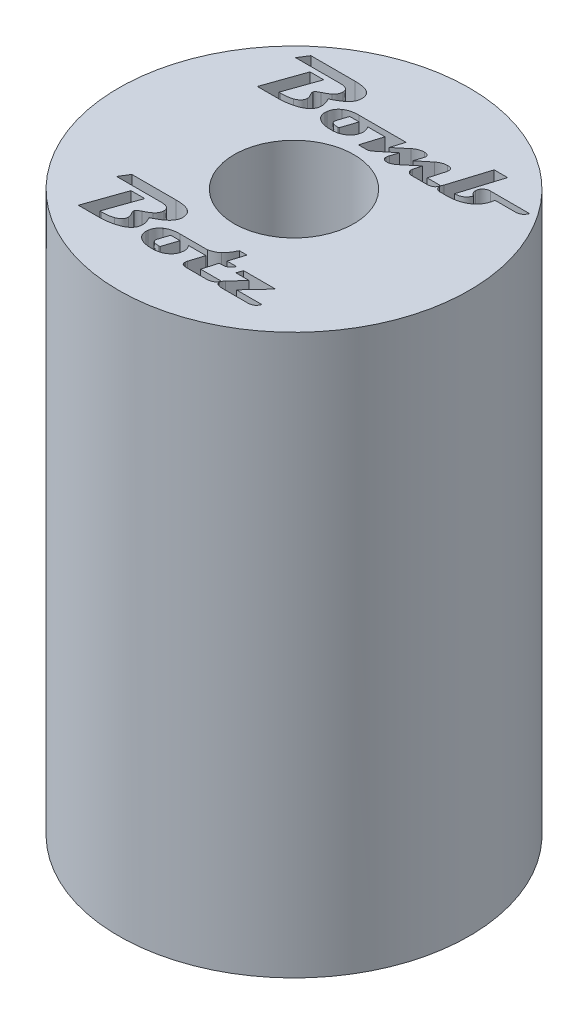
from build123d import *

# Parameters (mm, degrees)
SKETCH1_R           = 10.414
BOSS_EXTRUDE1_DEPTH = 34.798
SKETCH2_R           = 3.556
CUT_EXTRUDE1_DEPTH  = 34.798
CUT_EXTRUDE2_DEPTH  = 2.54
CUT_EXTRUDE3_DEPTH  = 2.54
SKETCH5_R           = 10.414
CUT_EXTRUDE4_DEPTH  = 1.5875


with BuildPart() as part:
    # Sketch1 → Boss-Extrude1 (new body)
    with BuildSketch(Plane(origin=(0, 0, 0), x_dir=(1, 0, 0), z_dir=(0, 1, 0))):
        with Locations(Location((0, 0, 0), (0, 0, 270))):
            Circle(SKETCH1_R)
    extrude(amount=BOSS_EXTRUDE1_DEPTH)

    # Sketch2 → Cut-Extrude1 (cut)
    with BuildSketch(Plane(origin=(0, 34.798, 0), x_dir=(1, 0, 0), z_dir=(0, 1, 0))):
        with Locations(Location((0, 0, 0), (0, 0, 270))):
            Circle(SKETCH2_R)
    extrude(amount=-CUT_EXTRUDE1_DEPTH, mode=Mode.SUBTRACT)

    # Sketch3 → Cut-Extrude2 (cut)
    # profile 1 of 4: a face of its own
    with BuildSketch(Plane(origin=(0, 34.798, 0), x_dir=(1, 0, 0), z_dir=(0, 1, 0))):
        with BuildLine():
            add(Edge.make_bspline(
                [(-2.639323682, 6.655505069), (-2.640257841, 6.627920843), (-2.642120978, 6.572905325), (-2.660323465, 6.491560511), (-2.686788544, 6.411133385), (-2.725680783, 6.332207712), (-2.775669719, 6.255242578), (-2.836178064, 6.179491707), (-2.907290136, 6.104982299), (-2.960926582, 6.058632058), (-2.988600498, 6.034717485)],
                knots=[0, 0, 0, 0, 0.897728408, 1.790479602, 2.704835107, 3.65271708, 4.64870854, 5.690615823, 6.808464946, 8, 8, 8, 8], degree=3))
            add(Edge.make_bspline(
                [(-2.988600498, 6.034717485), (-3.007000622, 6.019776527), (-3.04528941, 5.988685911), (-3.108234785, 5.943919796), (-3.177672512, 5.897701707), (-3.254612313, 5.85109888), (-3.337346824, 5.801886305), (-3.427527735, 5.752619821), (-3.523984699, 5.701259321), (-3.591407946, 5.668255669), (-3.626148007, 5.651250424)],
                knots=[0, 0, 0, 0, 0.762818378, 1.58734759, 2.485155294, 3.447475053, 4.482567251, 5.583716273, 6.755001493, 8, 8, 8, 8], degree=3))
            add(Edge.make_bspline(
                [(-3.626148007, 5.651250424), (-3.612492101, 5.626575614), (-3.585863402, 5.578460309), (-3.551050884, 5.505914721), (-3.521207388, 5.435316908), (-3.497092853, 5.366333186), (-3.478130246, 5.299185034), (-3.464600633, 5.233790105), (-3.456166881, 5.170127282), (-3.455066052, 5.128141469), (-3.454526385, 5.10755849)],
                knots=[0, 0, 0, 0, 1.174121996, 2.289510624, 3.348879741, 4.364175923, 5.330489301, 6.25208496, 7.143108216, 8, 8, 8, 8], degree=3))
            add(Edge.make_bspline(
                [(-3.454526385, 5.10755849), (-3.455098631, 5.086980235), (-3.456234317, 5.046140416), (-3.463548943, 4.985959095), (-3.476305413, 4.927794143), (-3.494671859, 4.872056332), (-3.517348069, 4.818003802), (-3.545837007, 4.766397324), (-3.578739355, 4.716407844), (-3.617196077, 4.668670685), (-3.660973764, 4.623226953), (-3.709418913, 4.579321964), (-3.763251979, 4.538049428), (-3.821581966, 4.498101026), (-3.885892221, 4.461574208), (-3.954525885, 4.425901747), (-4.028853301, 4.393128995), (-4.080375064, 4.373053025), (-4.106822627, 4.362747468)],
                knots=[0, 0, 0, 0, 0.930762157, 1.847200212, 2.737400411, 3.619588674, 4.498179705, 5.384699949, 6.281759375, 7.202035291, 8.152832479, 9.1332533, 10.156253164, 11.218736018, 12.328253921, 13.499059235, 14.716197083, 16, 16, 16, 16], degree=3))
            add(Edge.make_bspline(
                [(-4.106822627, 4.362747468), (-4.146466281, 4.348925535), (-4.226464054, 4.321033964), (-4.35050715, 4.286333614), (-4.479164833, 4.256921012), (-4.612941023, 4.232776971), (-4.751419543, 4.214180302), (-4.894773857, 4.200817703), (-5.042823565, 4.192616535), (-5.143245708, 4.191627664), (-5.194206495, 4.191125846)],
                knots=[0, 0, 0, 0, 0.910500009, 1.837317329, 2.792105238, 3.772355063, 4.784863345, 5.821858577, 6.894668061, 8, 8, 8, 8], degree=3))
            Line((-5.194206495, 4.191125846), (-6.372093953, 4.191125846))
            Line((-6.372093953, 4.191125846), (-5.55689125, 6.508017738))
            Line((-5.55689125, 6.508017738), (-4.74101815, 6.508017738))
            Line((-4.74101815, 6.508017738), (-5.436890194, 4.534369089))
            Line((-5.436890194, 4.534369089), (-5.323593108, 4.534369089))
            add(Edge.make_bspline(
                [(-5.323593108, 4.534369089), (-5.261428374, 4.535560384), (-5.141553774, 4.537857602), (-4.969388946, 4.554356283), (-4.811580271, 4.58212015), (-4.713745036, 4.611875938), (-4.666604088, 4.626213473)],
                knots=[0, 0, 0, 0, 1.119726035, 2.159209934, 3.113033349, 4, 4, 4, 4], degree=3))
            add(Edge.make_bspline(
                [(-4.666604088, 4.626213473), (-4.635209507, 4.637973902), (-4.575224084, 4.660444479), (-4.494203606, 4.704628616), (-4.424847023, 4.753243256), (-4.368293394, 4.808247106), (-4.32339765, 4.868571559), (-4.292549485, 4.935511424), (-4.272769047, 5.00766025), (-4.270756541, 5.057817319), (-4.269729088, 5.083424199)],
                knots=[0, 0, 0, 0, 1.235683897, 2.361013278, 3.395291283, 4.351587988, 5.260345797, 6.153024808, 7.057056699, 8, 8, 8, 8], degree=3))
            add(Edge.make_bspline(
                [(-4.269729088, 5.083424199), (-4.270897897, 5.101178368), (-4.273395162, 5.139111708), (-4.290976065, 5.197684032), (-4.317988609, 5.261063543), (-4.355108968, 5.325016942), (-4.391960784, 5.386736404), (-4.41884019, 5.443163484), (-4.436908484, 5.489967391), (-4.440017286, 5.51885775), (-4.441350709, 5.531249368)],
                knots=[0, 0, 0, 0, 0.878868266, 1.877779235, 3.008481529, 4.286715377, 5.53601311, 6.565782224, 7.38483702, 8, 8, 8, 8], degree=3))
            add(Edge.make_bspline(
                [(-4.441350709, 5.531249368), (-4.44127029, 5.54045414), (-4.441136075, 5.555816331), (-4.437939265, 5.570821887), (-4.436657931, 5.576836361)],
                knots=[0, 0, 0, 0, 1.198367028, 2, 2, 2, 2], degree=3))
            add(Edge.make_bspline(
                [(-4.436657931, 5.576836361), (-4.426194835, 5.593938034), (-4.403050087, 5.631767557), (-4.347140129, 5.680953545), (-4.272430561, 5.728624061), (-4.21465204, 5.757109618), (-4.18324788, 5.772592274)],
                knots=[0, 0, 0, 0, 0.735710686, 1.627418776, 2.710439134, 4, 4, 4, 4], degree=3))
            add(Edge.make_bspline(
                [(-4.18324788, 5.772592274), (-4.138278926, 5.79396403), (-4.053813257, 5.83410683), (-3.939495523, 5.898214482), (-3.842695694, 5.957215911), (-3.788467639, 6.00068759), (-3.763579383, 6.020639149)],
                knots=[0, 0, 0, 0, 1.221943044, 2.295188721, 3.217567763, 4, 4, 4, 4], degree=3))
            add(Edge.make_bspline(
                [(-3.763579383, 6.020639149), (-3.745843832, 6.036411831), (-3.71119367, 6.067227112), (-3.665646811, 6.117581551), (-3.626961934, 6.169634389), (-3.595044382, 6.223376235), (-3.570786547, 6.279563446), (-3.553451561, 6.3373831), (-3.54201875, 6.396953675), (-3.54090121, 6.437350177), (-3.540337196, 6.457737966)],
                knots=[0, 0, 0, 0, 1.121998031, 2.192061215, 3.204672358, 4.185392352, 5.141656817, 6.09129737, 7.036693171, 8, 8, 8, 8], degree=3))
            add(Edge.make_bspline(
                [(-3.540337196, 6.457737966), (-3.540737449, 6.471830385), (-3.541522723, 6.499478944), (-3.547235063, 6.539688021), (-3.558465668, 6.576782363), (-3.572200382, 6.611629537), (-3.591380591, 6.643205807), (-3.614313612, 6.672520141), (-3.64185241, 6.698439748), (-3.673489485, 6.721604192), (-3.708661441, 6.742287667), (-3.748432077, 6.759635811), (-3.791731634, 6.775293292), (-3.839949984, 6.786848656), (-3.891753237, 6.797192448), (-3.948033033, 6.803557755), (-4.008211363, 6.807659783), (-4.049831183, 6.808118861), (-4.071291588, 6.808355576)],
                knots=[0, 0, 0, 0, 0.937953779, 1.840214304, 2.692042798, 3.512259584, 4.325843598, 5.141056955, 5.982567789, 6.83322717, 7.746330073, 8.691564934, 9.716930283, 10.806196192, 11.987412167, 13.230656729, 14.572045042, 16, 16, 16, 16], degree=3))
            Line((-4.071291588, 6.808355576), (-6.715337196, 6.808355576))
            Line((-6.715337196, 6.808355576), (-6.368071571, 7.366125846))
            Line((-6.368071571, 7.366125846), (-3.735422711, 7.366125846))
            add(Edge.make_bspline(
                [(-3.735422711, 7.366125846), (-3.693623766, 7.365828929), (-3.612426256, 7.365252146), (-3.494802479, 7.358281193), (-3.385129402, 7.347960683), (-3.283700858, 7.332696994), (-3.190345325, 7.312655766), (-3.10503278, 7.288530767), (-3.027198219, 7.261116476), (-2.979902787, 7.237434755), (-2.957091841, 7.226012882)],
                knots=[0, 0, 0, 0, 1.256746755, 2.441322517, 3.541898803, 4.568277561, 5.523823565, 6.410850237, 7.23354099, 8, 8, 8, 8], degree=3))
            add(Edge.make_bspline(
                [(-2.957091841, 7.226012882), (-2.931791501, 7.211321072), (-2.882300825, 7.182582027), (-2.817640596, 7.127831376), (-2.761751416, 7.067239038), (-2.716225703, 6.998799805), (-2.682183982, 6.922673102), (-2.657413462, 6.839993764), (-2.641406475, 6.750198805), (-2.640033029, 6.687755348), (-2.639323682, 6.655505069)],
                knots=[0, 0, 0, 0, 1.016794796, 1.988979663, 2.936190502, 3.879110517, 4.836521918, 5.828337036, 6.878397495, 8, 8, 8, 8], degree=3))
        make_face()
    # profile 2 of 4: a face of its own
    with BuildSketch(Plane(origin=(0, 34.798, 0), x_dir=(1, 0, 0), z_dir=(0, 1, 0))):
        with BuildLine():
            add(Edge.make_bspline(
                [(0.921824966, 5.735720441), (0.913441583, 5.708501066), (0.897173822, 5.655682503), (0.856582376, 5.584676373), (0.804816788, 5.524393773), (0.741061374, 5.475410784), (0.665935035, 5.43767316), (0.579821814, 5.411326872), (0.482652984, 5.3950869), (0.414180469, 5.393377247), (0.378133032, 5.392477197)],
                knots=[0, 0, 0, 0, 0.974814121, 1.891604083, 2.783133621, 3.684923962, 4.631341703, 5.652256529, 6.764027661, 8, 8, 8, 8], degree=3))
            Line((0.378133032, 5.392477197), (-1.040426934, 5.392477197))
            add(Edge.make_bspline(
                [(-1.040426934, 5.392477197), (-1.028116517, 5.382663883), (-1.002051862, 5.361886304), (-0.970519394, 5.31878722), (-0.941326595, 5.266421158), (-0.917523737, 5.205461584), (-0.898036471, 5.141963798), (-0.884237727, 5.080856302), (-0.877322117, 5.023886385), (-0.879267843, 4.98756596), (-0.880202061, 4.970127113)],
                knots=[0, 0, 0, 0, 0.806255924, 1.70707325, 2.720293289, 3.885133511, 5.06259621, 6.133017354, 7.103589112, 8, 8, 8, 8], degree=3))
            add(Edge.make_bspline(
                [(-0.880202061, 4.970127113), (-0.883589985, 4.938522109), (-0.89020428, 4.87681918), (-0.91067974, 4.78735116), (-0.939547361, 4.703025088), (-0.977016392, 4.623793876), (-1.023265888, 4.550052518), (-1.077089595, 4.481233861), (-1.139706468, 4.417556272), (-1.187235959, 4.380764923), (-1.211378159, 4.362077071)],
                knots=[0, 0, 0, 0, 1.065603711, 2.080394318, 3.07136878, 4.05053362, 5.01363956, 5.985430025, 6.976716351, 8, 8, 8, 8], degree=3))
            add(Edge.make_bspline(
                [(-1.211378159, 4.362077071), (-1.235618189, 4.344992425), (-1.284563388, 4.310495299), (-1.364962236, 4.268429903), (-1.449804146, 4.230850227), (-1.540396349, 4.201113447), (-1.636286816, 4.177423148), (-1.737406611, 4.16099524), (-1.844028976, 4.150834156), (-1.916836165, 4.149106521), (-1.95417799, 4.148220441)],
                knots=[0, 0, 0, 0, 0.904482485, 1.826320996, 2.764277135, 3.735128293, 4.732909638, 5.77712291, 6.859916316, 8, 8, 8, 8], degree=3))
            add(Edge.make_bspline(
                [(-1.95417799, 4.148220441), (-1.997104212, 4.148312585), (-2.080613258, 4.148491842), (-2.202157132, 4.15833626), (-2.316319847, 4.173724404), (-2.422388427, 4.197526087), (-2.521335852, 4.226671302), (-2.612358243, 4.26365365), (-2.696636037, 4.306628257), (-2.746755527, 4.342455106), (-2.771391883, 4.36006588)],
                knots=[0, 0, 0, 0, 1.198628162, 2.331821666, 3.403500158, 4.413659066, 5.365491277, 6.281208672, 7.155123997, 8, 8, 8, 8], degree=3))
            add(Edge.make_bspline(
                [(-2.771391883, 4.36006588), (-2.791680907, 4.376148522), (-2.831433446, 4.407659447), (-2.883276049, 4.461859988), (-2.927175185, 4.519679951), (-2.962990961, 4.581440534), (-2.991598358, 4.646497813), (-3.010681751, 4.71586925), (-3.023353313, 4.78865571), (-3.024756231, 4.838673502), (-3.025472331, 4.864204393)],
                knots=[0, 0, 0, 0, 1.057900847, 2.072758456, 3.058045874, 4.020559661, 4.986668567, 5.955885328, 6.956609876, 8, 8, 8, 8], degree=3))
            add(Edge.make_bspline(
                [(-3.025472331, 4.864204393), (-3.025072583, 4.884808777), (-3.024269497, 4.926202591), (-3.017483666, 4.967044959), (-3.014075583, 4.987557434)],
                knots=[0, 0, 0, 0, 0.995529625, 2, 2, 2, 2], degree=3))
            add(Edge.make_bspline(
                [(-3.014075583, 4.987557434), (-3.008559635, 5.015612853), (-2.997709668, 5.070798354), (-2.972746615, 5.150414228), (-2.940190339, 5.225221397), (-2.901518697, 5.295738042), (-2.855556347, 5.361504423), (-2.801930054, 5.42178566), (-2.742645547, 5.478712453), (-2.698044583, 5.511395428), (-2.675525118, 5.527897383)],
                knots=[0, 0, 0, 0, 1.046248039, 2.057988234, 3.047385253, 4.028766979, 4.997932427, 5.977675898, 6.978908713, 8, 8, 8, 8], degree=3))
            add(Edge.make_bspline(
                [(-2.675525118, 5.527897383), (-2.649914684, 5.544736335), (-2.598148156, 5.578773012), (-2.513649734, 5.620713904), (-2.423179647, 5.656236833), (-2.326703162, 5.686033116), (-2.223529859, 5.707309649), (-2.114905184, 5.724692518), (-1.999692372, 5.7336603), (-1.920894371, 5.735021508), (-1.880434324, 5.735720441)],
                knots=[0, 0, 0, 0, 0.880847075, 1.780461621, 2.70656802, 3.674265997, 4.68017856, 5.733644912, 6.836305091, 8, 8, 8, 8], degree=3))
            Line((-1.880434324, 5.735720441), (0.921824966, 5.735720441))
        make_face()
        with BuildLine():
            Line((-1.523783142, 5.392477197), (-2.081553412, 5.392477197))
            Line((-2.081553412, 5.392477197), (-2.280661309, 4.785767949))
            add(Edge.make_bspline(
                [(-2.280661309, 4.785767949), (-2.285071116, 4.77045124), (-2.293593415, 4.740850494), (-2.295270939, 4.710102168), (-2.296080439, 4.69526436)],
                knots=[0, 0, 0, 0, 1.034886721, 2, 2, 2, 2], degree=3))
            add(Edge.make_bspline(
                [(-2.296080439, 4.69526436), (-2.295084734, 4.679178298), (-2.293142558, 4.647801562), (-2.272943134, 4.604716281), (-2.241212325, 4.568279689), (-2.19677046, 4.539511734), (-2.140362798, 4.517805578), (-2.072439183, 4.502241432), (-1.992405845, 4.493220843), (-1.935208322, 4.492076623), (-1.904568615, 4.491463684)],
                knots=[0, 0, 0, 0, 0.780468762, 1.522346627, 2.272276054, 3.11311277, 4.077040892, 5.209140603, 6.50498569, 8, 8, 8, 8], degree=3))
            add(Edge.make_bspline(
                [(-1.904568615, 4.491463684), (-1.890037977, 4.491533483), (-1.863195363, 4.491662424), (-1.836407735, 4.493364552), (-1.82412098, 4.494145272)],
                knots=[0, 0, 0, 0, 1.082654509, 2, 2, 2, 2], degree=3))
            Line((-1.82412098, 4.494145272), (-1.523783142, 5.392477197))
        make_face(mode=Mode.SUBTRACT)
    # profile 3 of 4: a face of its own
    with BuildSketch(Plane(origin=(0, 34.798, 0), x_dir=(1, 0, 0), z_dir=(0, 1, 0))):
        with BuildLine():
            add(Edge.make_bspline(
                [(4.182635777, 4.534369089), (4.176257946, 4.507233754), (4.163966565, 4.454938432), (4.129723797, 4.383605202), (4.083288628, 4.323100617), (4.024218219, 4.274170713), (3.95356668, 4.236160538), (3.871323408, 4.209884205), (3.777675525, 4.193730517), (3.711418554, 4.192025027), (3.676486073, 4.191125846)],
                knots=[0, 0, 0, 0, 0.99149646, 1.910815747, 2.796806556, 3.690358489, 4.624369187, 5.639649257, 6.75555877, 8, 8, 8, 8], degree=3))
            Line((3.676486073, 4.191125846), (2.772120574, 4.191125846))
            add(Edge.make_bspline(
                [(2.772120574, 4.191125846), (2.754571307, 4.192174839), (2.719183992, 4.194290088), (2.667568821, 4.211212829), (2.618437278, 4.238815946), (2.573483889, 4.275870777), (2.533926645, 4.318884537), (2.505711437, 4.367246212), (2.486433202, 4.418091337), (2.484714507, 4.453525757), (2.483849882, 4.471351775)],
                knots=[0, 0, 0, 0, 0.953018249, 1.921718768, 2.922818182, 4.002921641, 5.078914059, 6.081561737, 7.034889961, 8, 8, 8, 8], degree=3))
            add(Edge.make_bspline(
                [(2.483849882, 4.471351775), (2.484406173, 4.482795349), (2.485516947, 4.505645267), (2.490665404, 4.527935107), (2.493235439, 4.539061868)],
                knots=[0, 0, 0, 0, 1.001629293, 2, 2, 2, 2], degree=3))
            add(Edge.make_bspline(
                [(2.493235439, 4.539061868), (2.501238777, 4.569017521), (2.518813694, 4.634798595), (2.548622769, 4.742424681), (2.583326914, 4.868279112), (2.608511637, 4.95829232), (2.621951655, 5.006328549)],
                knots=[0, 0, 0, 0, 0.76768028, 1.685786406, 2.765002404, 4, 4, 4, 4], degree=3))
            Line((2.621951655, 5.006328549), (1.873118252, 4.38218898))
            add(Edge.make_bspline(
                [(1.873118252, 4.38218898), (1.850067838, 4.363617752), (1.805672122, 4.32784907), (1.738519947, 4.28017527), (1.674150435, 4.239694146), (1.612262178, 4.206388155), (1.552779427, 4.180801303), (1.495777158, 4.162530966), (1.441482266, 4.150020903), (1.405690301, 4.148806413), (1.38842125, 4.148220441)],
                knots=[0, 0, 0, 0, 1.296105666, 2.496334262, 3.604237583, 4.624332256, 5.571396642, 6.434881891, 7.244855559, 8, 8, 8, 8], degree=3))
            add(Edge.make_bspline(
                [(1.38842125, 4.148220441), (1.364921335, 4.149043936), (1.320555989, 4.150598607), (1.258427307, 4.160608447), (1.205496528, 4.179298026), (1.162251661, 4.205980971), (1.127011964, 4.239299108), (1.103418585, 4.281920062), (1.089004865, 4.331430855), (1.087522591, 4.366884994), (1.086742618, 4.385540964)],
                knots=[0, 0, 0, 0, 1.288056299, 2.431713562, 3.435164107, 4.342616441, 5.200009575, 6.06132992, 6.979871696, 8, 8, 8, 8], degree=3))
            add(Edge.make_bspline(
                [(1.086742618, 4.385540964), (1.088591306, 4.41256285), (1.092510165, 4.469843986), (1.110669593, 4.524347995), (1.120262466, 4.553140204)],
                knots=[0, 0, 0, 0, 0.943482878, 2, 2, 2, 2], degree=3))
            Line((1.120262466, 4.553140204), (1.265068209, 5.006328549))
            Line((1.265068209, 5.006328549), (0.374781047, 4.284311024))
            add(Edge.make_bspline(
                [(0.374781047, 4.284311024), (0.355185403, 4.269797825), (0.315805219, 4.240631524), (0.24635906, 4.212505439), (0.171025359, 4.194376649), (0.118357342, 4.192231716), (0.091203133, 4.191125846)],
                knots=[0, 0, 0, 0, 0.958271537, 1.925780514, 2.93058841, 4, 4, 4, 4], degree=3))
            Line((0.091203133, 4.191125846), (-0.365337196, 4.191125846))
            Line((-0.365337196, 4.191125846), (0.114667027, 5.735720441))
            Line((0.114667027, 5.735720441), (0.919143378, 5.735720441))
            Line((0.919143378, 5.735720441), (0.682493252, 4.968115922))
            Line((0.682493252, 4.968115922), (1.385739662, 5.556724453))
            add(Edge.make_bspline(
                [(1.385739662, 5.556724453), (1.407767415, 5.574590017), (1.451137057, 5.609764878), (1.520739572, 5.654286665), (1.591339895, 5.693354738), (1.664788524, 5.723944253), (1.740114546, 5.748322399), (1.817321112, 5.765539104), (1.896464533, 5.776967987), (1.949950022, 5.778068603), (1.97702978, 5.778625846)],
                knots=[0, 0, 0, 0, 1.054420173, 2.076009588, 3.069330367, 4.052965778, 5.031069067, 6.011325487, 6.993132056, 8, 8, 8, 8], degree=3))
            add(Edge.make_bspline(
                [(1.97702978, 5.778625846), (1.998090893, 5.778336446), (2.037773464, 5.777791169), (2.093047965, 5.767917885), (2.140838143, 5.754345072), (2.179406895, 5.732172284), (2.21017303, 5.704874121), (2.232441201, 5.670793816), (2.245281031, 5.630233372), (2.246542983, 5.601286879), (2.247199755, 5.586221919)],
                knots=[0, 0, 0, 0, 1.338371947, 2.521710924, 3.565490147, 4.482983206, 5.328870011, 6.161374167, 7.043102513, 8, 8, 8, 8], degree=3))
            add(Edge.make_bspline(
                [(2.247199755, 5.586221919), (2.246009697, 5.56684008), (2.24346977, 5.525473627), (2.229708586, 5.486345499), (2.222395068, 5.465550466)],
                knots=[0, 0, 0, 0, 0.937080074, 2, 2, 2, 2], degree=3))
            Line((2.222395068, 5.465550466), (2.071555752, 4.993591007))
            Line((2.071555752, 4.993591007), (2.778154147, 5.568121201))
            add(Edge.make_bspline(
                [(2.778154147, 5.568121201), (2.79951719, 5.585092499), (2.841575516, 5.618504611), (2.909401417, 5.660589768), (2.978446178, 5.696795592), (3.048963587, 5.727549438), (3.121856369, 5.7503017), (3.196408744, 5.766100734), (3.272600414, 5.776800076), (3.324044245, 5.778013536), (3.350002753, 5.778625846)],
                knots=[0, 0, 0, 0, 1.052193059, 2.071496925, 3.074470867, 4.0596751, 5.036158861, 6.01557073, 6.998658842, 8, 8, 8, 8], degree=3))
            add(Edge.make_bspline(
                [(3.350002753, 5.778625846), (3.373296825, 5.777924663), (3.416851953, 5.776613594), (3.477721493, 5.765259363), (3.52961848, 5.746635196), (3.573251453, 5.720647081), (3.606772884, 5.685049927), (3.629414701, 5.641565769), (3.644173574, 5.591182232), (3.645576285, 5.555052144), (3.646318209, 5.535942147)],
                knots=[0, 0, 0, 0, 1.276739742, 2.387241022, 3.379898468, 4.287998429, 5.146353526, 6.02374704, 6.954716408, 8, 8, 8, 8], degree=3))
            add(Edge.make_bspline(
                [(3.646318209, 5.535942147), (3.645954702, 5.521838612), (3.645206466, 5.492808228), (3.638012658, 5.448382816), (3.626581513, 5.401741353), (3.615746179, 5.370497202), (3.610116774, 5.354264571)],
                knots=[0, 0, 0, 0, 0.90837764, 1.869783218, 2.893264101, 4, 4, 4, 4], degree=3))
            Line((3.610116774, 5.354264571), (3.377489029, 4.534369089))
            Line((3.377489029, 4.534369089), (4.182635777, 4.534369089))
        make_face()
    # profile 4 of 4: a face of its own
    with BuildSketch(Plane(origin=(0, 34.798, 0), x_dir=(1, 0, 0), z_dir=(0, 1, 0))):
        with BuildLine():
            add(Edge.make_bspline(
                [(8.258649291, 5.735720441), (8.245966725, 5.708509584), (8.221433518, 5.655872791), (8.173868025, 5.585705461), (8.120704712, 5.525795858), (8.061026048, 5.476824842), (7.994981995, 5.438544533), (7.922407531, 5.41185268), (7.843526463, 5.395259106), (7.78878643, 5.393423991), (7.76054435, 5.392477197)],
                knots=[0, 0, 0, 0, 1.115206191, 2.157259482, 3.14025187, 4.085366729, 5.016376528, 5.965904001, 6.950546796, 8, 8, 8, 8], degree=3))
            Line((7.76054435, 5.392477197), (6.542433074, 5.392477197))
            add(Edge.make_bspline(
                [(6.542433074, 5.392477197), (6.533847826, 5.339021089), (6.517037115, 5.234349083), (6.471127295, 5.084712565), (6.411604155, 4.945342798), (6.336081026, 4.817006408), (6.244650393, 4.699938114), (6.137688615, 4.594484989), (6.016573751, 4.498502126), (5.92617439, 4.446332072), (5.880080878, 4.419731209)],
                knots=[0, 0, 0, 0, 1.059465003, 2.074530497, 3.056825323, 4.022268175, 4.982836178, 5.957847538, 6.958731833, 8, 8, 8, 8], degree=3))
            add(Edge.make_bspline(
                [(5.880080878, 4.419731209), (5.844357648, 4.40131221), (5.772729832, 4.364380703), (5.659955425, 4.318489826), (5.543408712, 4.278787405), (5.422036227, 4.246404223), (5.29628996, 4.222102766), (5.166324264, 4.203764343), (5.031994589, 4.19285001), (4.940874817, 4.191706571), (4.894597348, 4.191125846)],
                knots=[0, 0, 0, 0, 0.943308606, 1.891406092, 2.855442252, 3.832907148, 4.83826654, 5.860799809, 6.913553353, 8, 8, 8, 8], degree=3))
            Line((4.894597348, 4.191125846), (4.485655203, 4.191125846))
            add(Edge.make_bspline(
                [(4.485655203, 4.191125846), (4.467957961, 4.191767301), (4.433161025, 4.193028552), (4.382621828, 4.203021379), (4.335547599, 4.220793985), (4.306908818, 4.237213394), (4.292580878, 4.245428)],
                knots=[0, 0, 0, 0, 1.044289679, 2.053318855, 3.026078302, 4, 4, 4, 4], degree=3))
            add(Edge.make_bspline(
                [(4.292580878, 4.245428), (4.275600799, 4.258178811), (4.242300834, 4.283184675), (4.207667986, 4.336079952), (4.185598512, 4.397245694), (4.183656849, 4.441418448), (4.182635777, 4.464647806)],
                knots=[0, 0, 0, 0, 0.988520934, 1.938607685, 2.91596484, 4, 4, 4, 4], degree=3))
            add(Edge.make_bspline(
                [(4.182635777, 4.464647806), (4.183227096, 4.479248354), (4.18446299, 4.509764405), (4.197235967, 4.556162029), (4.215066345, 4.605559827), (4.232051165, 4.638016075), (4.240960312, 4.655040542)],
                knots=[0, 0, 0, 0, 0.869358243, 1.817012681, 2.854944787, 4, 4, 4, 4], degree=3))
            Line((4.240960312, 4.655040542), (4.950240296, 6.937071792))
            Line((4.950240296, 6.937071792), (5.748012677, 6.937071792))
            Line((5.748012677, 6.937071792), (5.00655364, 4.535039486))
            add(Edge.make_bspline(
                [(5.00655364, 4.535039486), (5.044855823, 4.535214224), (5.119077647, 4.535552828), (5.226226285, 4.555272918), (5.32523728, 4.587062783), (5.415913852, 4.633846451), (5.496921193, 4.695903092), (5.56968182, 4.771428106), (5.632965905, 4.861560557), (5.666845338, 4.928755062), (5.684324966, 4.963423143)],
                knots=[0, 0, 0, 0, 1.07249176, 2.078270447, 3.041590553, 3.98074896, 4.924726752, 5.891100823, 6.911942458, 8, 8, 8, 8], degree=3))
            add(Edge.make_bspline(
                [(5.684324966, 4.963423143), (5.667274208, 4.974191217), (5.634116957, 4.995131032), (5.590519676, 5.032418848), (5.552935041, 5.072115437), (5.522639037, 5.115338271), (5.498850911, 5.161320671), (5.481931486, 5.210288604), (5.471646108, 5.262213406), (5.470420922, 5.297904001), (5.469797939, 5.316051944)],
                knots=[0, 0, 0, 0, 1.115441843, 2.169110959, 3.167252835, 4.135411278, 5.081814168, 6.024975387, 6.995740126, 8, 8, 8, 8], degree=3))
            add(Edge.make_bspline(
                [(5.469797939, 5.316051944), (5.471447518, 5.344192376), (5.47469931, 5.399665212), (5.50149077, 5.479130533), (5.544691897, 5.551991378), (5.604679904, 5.615024141), (5.674830473, 5.66899961), (5.754626628, 5.707142847), (5.840590776, 5.732171899), (5.900460584, 5.734520969), (5.931031047, 5.735720441)],
                knots=[0, 0, 0, 0, 0.974106845, 1.920243053, 2.876013814, 3.890691073, 4.920035158, 5.928803845, 6.942414768, 8, 8, 8, 8], degree=3))
            Line((5.931031047, 5.735720441), (8.258649291, 5.735720441))
        make_face()
    extrude(amount=-CUT_EXTRUDE2_DEPTH, mode=Mode.SUBTRACT)

    # Sketch4 → Cut-Extrude3 (cut)
    # profile 1 of 4: a face of its own
    with BuildSketch(Plane(origin=(0, 34.798, 0), x_dir=(1, 0, 0), z_dir=(0, 1, 0))):
        with BuildLine():
            add(Edge.make_bspline(
                [(-1.846175789, -4.768769503), (-1.847109947, -4.796353728), (-1.848973084, -4.851369247), (-1.867175572, -4.932714061), (-1.89364065, -5.013141187), (-1.93253289, -5.09206686), (-1.982521825, -5.169031994), (-2.04303017, -5.244782865), (-2.114142242, -5.319292273), (-2.167778688, -5.365642514), (-2.195452604, -5.389557087)],
                knots=[0, 0, 0, 0, 0.897728408, 1.790479602, 2.704835107, 3.65271708, 4.64870854, 5.690615823, 6.808464946, 8, 8, 8, 8], degree=3))
            add(Edge.make_bspline(
                [(-2.195452604, -5.389557087), (-2.213852728, -5.404498045), (-2.252141517, -5.435588661), (-2.315086891, -5.480354775), (-2.384524618, -5.526572864), (-2.461464419, -5.573175692), (-2.54419893, -5.622388267), (-2.634379841, -5.671654751), (-2.730836805, -5.723015251), (-2.798260052, -5.756018903), (-2.833000113, -5.773024148)],
                knots=[0, 0, 0, 0, 0.762818378, 1.58734759, 2.485155294, 3.447475053, 4.482567251, 5.583716273, 6.755001493, 8, 8, 8, 8], degree=3))
            add(Edge.make_bspline(
                [(-2.833000113, -5.773024148), (-2.819344207, -5.797698958), (-2.792715508, -5.845814263), (-2.75790299, -5.918359851), (-2.728059494, -5.988957664), (-2.703944959, -6.057941386), (-2.684982352, -6.125089538), (-2.671452739, -6.190484467), (-2.663018987, -6.25414729), (-2.661918158, -6.296133103), (-2.661378491, -6.316716082)],
                knots=[0, 0, 0, 0, 1.174121996, 2.289510624, 3.348879741, 4.364175923, 5.330489301, 6.25208496, 7.143108216, 8, 8, 8, 8], degree=3))
            add(Edge.make_bspline(
                [(-2.661378491, -6.316716082), (-2.661950738, -6.337294337), (-2.663086423, -6.378134156), (-2.67040105, -6.438315477), (-2.683157519, -6.496480429), (-2.701523965, -6.552218239), (-2.724200175, -6.60627077), (-2.752689114, -6.657877248), (-2.785591461, -6.707866728), (-2.824048183, -6.755603887), (-2.86782587, -6.801047618), (-2.916271019, -6.844952608), (-2.970104086, -6.886225144), (-3.028434073, -6.926173545), (-3.092744327, -6.962700364), (-3.161377991, -6.998372825), (-3.235705407, -7.031145577), (-3.28722717, -7.051221547), (-3.313674733, -7.061527104)],
                knots=[0, 0, 0, 0, 0.930762157, 1.847200212, 2.737400411, 3.619588674, 4.498179705, 5.384699949, 6.281759375, 7.202035291, 8.152832479, 9.1332533, 10.156253164, 11.218736018, 12.328253921, 13.499059235, 14.716197083, 16, 16, 16, 16], degree=3))
            add(Edge.make_bspline(
                [(-3.313674733, -7.061527104), (-3.353318387, -7.075349036), (-3.43331616, -7.103240607), (-3.557359256, -7.137940958), (-3.686016939, -7.16735356), (-3.819793129, -7.191497601), (-3.958271649, -7.21009427), (-4.101625963, -7.223456869), (-4.249675671, -7.231658037), (-4.350097814, -7.232646908), (-4.401058601, -7.233148726)],
                knots=[0, 0, 0, 0, 0.910500009, 1.837317329, 2.792105238, 3.772355063, 4.784863345, 5.821858577, 6.894668061, 8, 8, 8, 8], degree=3))
            Line((-4.401058601, -7.233148726), (-5.578946059, -7.233148726))
            Line((-5.578946059, -7.233148726), (-4.763743356, -4.916256834))
            Line((-4.763743356, -4.916256834), (-3.947870256, -4.916256834))
            Line((-3.947870256, -4.916256834), (-4.6437423, -6.889905482))
            Line((-4.6437423, -6.889905482), (-4.530445214, -6.889905482))
            add(Edge.make_bspline(
                [(-4.530445214, -6.889905482), (-4.46828048, -6.888714188), (-4.34840588, -6.88641697), (-4.176241053, -6.869918288), (-4.018432377, -6.842154422), (-3.920597143, -6.812398634), (-3.873456194, -6.798061099)],
                knots=[0, 0, 0, 0, 1.119726035, 2.159209934, 3.113033349, 4, 4, 4, 4], degree=3))
            add(Edge.make_bspline(
                [(-3.873456194, -6.798061099), (-3.842061614, -6.786300669), (-3.782076191, -6.763830092), (-3.701055712, -6.719645955), (-3.631699129, -6.671031316), (-3.575145501, -6.616027466), (-3.530249756, -6.555703013), (-3.499401591, -6.488763147), (-3.479621153, -6.416614321), (-3.477608647, -6.366457253), (-3.476581194, -6.340850373)],
                knots=[0, 0, 0, 0, 1.235683897, 2.361013278, 3.395291283, 4.351587988, 5.260345797, 6.153024808, 7.057056699, 8, 8, 8, 8], degree=3))
            add(Edge.make_bspline(
                [(-3.476581194, -6.340850373), (-3.477750004, -6.323096204), (-3.480247268, -6.285162864), (-3.497828171, -6.226590539), (-3.524840715, -6.163211029), (-3.561961074, -6.09925763), (-3.59881289, -6.037538168), (-3.625692297, -5.981111088), (-3.64376059, -5.934307181), (-3.646869392, -5.905416822), (-3.648202816, -5.893025204)],
                knots=[0, 0, 0, 0, 0.878868266, 1.877779235, 3.008481529, 4.286715377, 5.53601311, 6.565782224, 7.38483702, 8, 8, 8, 8], degree=3))
            add(Edge.make_bspline(
                [(-3.648202816, -5.893025204), (-3.648122396, -5.883820432), (-3.647988181, -5.868458241), (-3.644791371, -5.853452685), (-3.643510037, -5.84743821)],
                knots=[0, 0, 0, 0, 1.198367028, 2, 2, 2, 2], degree=3))
            add(Edge.make_bspline(
                [(-3.643510037, -5.84743821), (-3.633046941, -5.830336537), (-3.609902193, -5.792507015), (-3.553992235, -5.743321027), (-3.479282667, -5.695650511), (-3.421504146, -5.667164954), (-3.390099986, -5.651682298)],
                knots=[0, 0, 0, 0, 0.735710686, 1.627418776, 2.710439134, 4, 4, 4, 4], degree=3))
            add(Edge.make_bspline(
                [(-3.390099986, -5.651682298), (-3.345131032, -5.630310541), (-3.260665363, -5.590167742), (-3.146347629, -5.52606009), (-3.0495478, -5.467058661), (-2.995319745, -5.423586982), (-2.97043149, -5.403635423)],
                knots=[0, 0, 0, 0, 1.221943044, 2.295188721, 3.217567763, 4, 4, 4, 4], degree=3))
            add(Edge.make_bspline(
                [(-2.97043149, -5.403635423), (-2.952695939, -5.387862741), (-2.918045777, -5.35704746), (-2.872498917, -5.306693021), (-2.83381404, -5.254640183), (-2.801896488, -5.200898336), (-2.777638653, -5.144711126), (-2.760303667, -5.086891472), (-2.748870856, -5.027320897), (-2.747753316, -4.986924395), (-2.747189302, -4.966536606)],
                knots=[0, 0, 0, 0, 1.121998031, 2.192061215, 3.204672358, 4.185392352, 5.141656817, 6.09129737, 7.036693171, 8, 8, 8, 8], degree=3))
            add(Edge.make_bspline(
                [(-2.747189302, -4.966536606), (-2.747589555, -4.952444187), (-2.748374829, -4.924795628), (-2.754087169, -4.884586551), (-2.765317774, -4.847492209), (-2.779052488, -4.812645035), (-2.798232697, -4.781068764), (-2.821165718, -4.75175443), (-2.848704516, -4.725834823), (-2.880341591, -4.70267038), (-2.915513548, -4.681986905), (-2.955284184, -4.664638761), (-2.99858374, -4.64898128), (-3.04680209, -4.637425916), (-3.098605343, -4.627082123), (-3.154885139, -4.620716817), (-3.215063469, -4.616614789), (-3.256683289, -4.61615571), (-3.278143694, -4.615918996)],
                knots=[0, 0, 0, 0, 0.937953779, 1.840214304, 2.692042798, 3.512259584, 4.325843598, 5.141056955, 5.982567789, 6.83322717, 7.746330073, 8.691564934, 9.716930283, 10.806196192, 11.987412167, 13.230656729, 14.572045042, 16, 16, 16, 16], degree=3))
            Line((-3.278143694, -4.615918996), (-5.922189302, -4.615918996))
            Line((-5.922189302, -4.615918996), (-5.574923677, -4.058148726))
            Line((-5.574923677, -4.058148726), (-2.942274817, -4.058148726))
            add(Edge.make_bspline(
                [(-2.942274817, -4.058148726), (-2.900475872, -4.058445643), (-2.819278362, -4.059022425), (-2.701654585, -4.065993379), (-2.591981508, -4.076313889), (-2.490552964, -4.091577577), (-2.397197432, -4.111618806), (-2.311884886, -4.135743805), (-2.234050325, -4.163158096), (-2.186754893, -4.186839817), (-2.163943947, -4.19826169)],
                knots=[0, 0, 0, 0, 1.256746755, 2.441322517, 3.541898803, 4.568277561, 5.523823565, 6.410850237, 7.23354099, 8, 8, 8, 8], degree=3))
            add(Edge.make_bspline(
                [(-2.163943947, -4.19826169), (-2.138643607, -4.2129535), (-2.089152931, -4.241692545), (-2.024492702, -4.296443196), (-1.968603522, -4.357035533), (-1.923077809, -4.425474766), (-1.889036088, -4.50160147), (-1.864265568, -4.584280808), (-1.848258581, -4.674075767), (-1.846885135, -4.736519223), (-1.846175789, -4.768769503)],
                knots=[0, 0, 0, 0, 1.016794796, 1.988979663, 2.936190502, 3.879110517, 4.836521918, 5.828337036, 6.878397495, 8, 8, 8, 8], degree=3))
        make_face()
    # profile 2 of 4: a face of its own
    with BuildSketch(Plane(origin=(0, 34.798, 0), x_dir=(1, 0, 0), z_dir=(0, 1, 0))):
        with BuildLine():
            add(Edge.make_bspline(
                [(1.71497286, -5.688554131), (1.706589476, -5.715773506), (1.690321716, -5.768592069), (1.64973027, -5.839598199), (1.597964682, -5.899880799), (1.534209267, -5.948863787), (1.459082929, -5.986601412), (1.372969708, -6.012947699), (1.275800878, -6.029187672), (1.207328363, -6.030897325), (1.171280926, -6.031797374)],
                knots=[0, 0, 0, 0, 0.974814121, 1.891604083, 2.783133621, 3.684923962, 4.631341703, 5.652256529, 6.764027661, 8, 8, 8, 8], degree=3))
            Line((1.171280926, -6.031797374), (-0.24727904, -6.031797374))
            add(Edge.make_bspline(
                [(-0.24727904, -6.031797374), (-0.234968624, -6.041610688), (-0.208903968, -6.062388267), (-0.1773715, -6.105487352), (-0.148178702, -6.157853414), (-0.124375844, -6.218812987), (-0.104888578, -6.282310774), (-0.091089833, -6.343418269), (-0.084174223, -6.400388187), (-0.086119949, -6.436708612), (-0.087054167, -6.454147459)],
                knots=[0, 0, 0, 0, 0.806255924, 1.70707325, 2.720293289, 3.885133511, 5.06259621, 6.133017354, 7.103589112, 8, 8, 8, 8], degree=3))
            add(Edge.make_bspline(
                [(-0.087054167, -6.454147459), (-0.090442091, -6.485752463), (-0.097056386, -6.547455392), (-0.117531847, -6.636923412), (-0.146399467, -6.721249484), (-0.183868498, -6.800480696), (-0.230117994, -6.874222054), (-0.283941701, -6.943040711), (-0.346558574, -7.0067183), (-0.394088065, -7.043509649), (-0.418230265, -7.062197501)],
                knots=[0, 0, 0, 0, 1.065603711, 2.080394318, 3.07136878, 4.05053362, 5.01363956, 5.985430025, 6.976716351, 8, 8, 8, 8], degree=3))
            add(Edge.make_bspline(
                [(-0.418230265, -7.062197501), (-0.442470295, -7.079282147), (-0.491415494, -7.113779273), (-0.571814342, -7.155844669), (-0.656656252, -7.193424344), (-0.747248455, -7.223161125), (-0.843138922, -7.246851423), (-0.944258718, -7.263279332), (-1.050881082, -7.273440416), (-1.123688271, -7.27516805), (-1.161030096, -7.276054131)],
                knots=[0, 0, 0, 0, 0.904482485, 1.826320996, 2.764277135, 3.735128293, 4.732909638, 5.77712291, 6.859916316, 8, 8, 8, 8], degree=3))
            add(Edge.make_bspline(
                [(-1.161030096, -7.276054131), (-1.203956318, -7.275961987), (-1.287465364, -7.275782729), (-1.409009238, -7.265938312), (-1.523171953, -7.250550167), (-1.629240534, -7.226748485), (-1.728187958, -7.19760327), (-1.819210349, -7.160620922), (-1.903488143, -7.117646314), (-1.953607634, -7.081819465), (-1.97824399, -7.064208692)],
                knots=[0, 0, 0, 0, 1.198628162, 2.331821666, 3.403500158, 4.413659066, 5.365491277, 6.281208672, 7.155123997, 8, 8, 8, 8], degree=3))
            add(Edge.make_bspline(
                [(-1.97824399, -7.064208692), (-1.998533013, -7.048126049), (-2.038285552, -7.016615125), (-2.090128155, -6.962414584), (-2.134027291, -6.904594621), (-2.169843067, -6.842834038), (-2.198450464, -6.777776759), (-2.217533857, -6.708405322), (-2.230205419, -6.635618862), (-2.231608337, -6.58560107), (-2.232324437, -6.560070178)],
                knots=[0, 0, 0, 0, 1.057900847, 2.072758456, 3.058045874, 4.020559661, 4.986668567, 5.955885328, 6.956609876, 8, 8, 8, 8], degree=3))
            add(Edge.make_bspline(
                [(-2.232324437, -6.560070178), (-2.231924689, -6.539465794), (-2.231121603, -6.498071981), (-2.224335772, -6.457229612), (-2.220927689, -6.436717138)],
                knots=[0, 0, 0, 0, 0.995529625, 2, 2, 2, 2], degree=3))
            add(Edge.make_bspline(
                [(-2.220927689, -6.436717138), (-2.215411741, -6.408661719), (-2.204561774, -6.353476218), (-2.179598721, -6.273860344), (-2.147042445, -6.199053175), (-2.108370803, -6.12853653), (-2.062408454, -6.062770149), (-2.00878216, -6.002488912), (-1.949497653, -5.945562119), (-1.904896689, -5.912879144), (-1.882377224, -5.896377188)],
                knots=[0, 0, 0, 0, 1.046248039, 2.057988234, 3.047385253, 4.028766979, 4.997932427, 5.977675898, 6.978908713, 8, 8, 8, 8], degree=3))
            add(Edge.make_bspline(
                [(-1.882377224, -5.896377188), (-1.85676679, -5.879538237), (-1.805000262, -5.845501559), (-1.72050184, -5.803560667), (-1.630031753, -5.768037739), (-1.533555269, -5.738241456), (-1.430381965, -5.716964923), (-1.32175729, -5.699582054), (-1.206544478, -5.690614272), (-1.127746477, -5.689253064), (-1.08728643, -5.688554131)],
                knots=[0, 0, 0, 0, 0.880847075, 1.780461621, 2.70656802, 3.674265997, 4.68017856, 5.733644912, 6.836305091, 8, 8, 8, 8], degree=3))
            Line((-1.08728643, -5.688554131), (1.71497286, -5.688554131))
        make_face()
        with BuildLine():
            Line((-0.730635248, -6.031797374), (-1.288405518, -6.031797374))
            Line((-1.288405518, -6.031797374), (-1.487513415, -6.638506623))
            add(Edge.make_bspline(
                [(-1.487513415, -6.638506623), (-1.491923222, -6.653823332), (-1.500445521, -6.683424078), (-1.502123045, -6.714172404), (-1.502932545, -6.729010212)],
                knots=[0, 0, 0, 0, 1.034886721, 2, 2, 2, 2], degree=3))
            add(Edge.make_bspline(
                [(-1.502932545, -6.729010212), (-1.50193684, -6.745096274), (-1.499994664, -6.77647301), (-1.47979524, -6.819558291), (-1.448064431, -6.855994883), (-1.403622566, -6.884762837), (-1.347214904, -6.906468993), (-1.279291289, -6.922033139), (-1.199257951, -6.931053729), (-1.142060428, -6.932197949), (-1.111420721, -6.932810888)],
                knots=[0, 0, 0, 0, 0.780468762, 1.522346627, 2.272276054, 3.11311277, 4.077040892, 5.209140603, 6.50498569, 8, 8, 8, 8], degree=3))
            add(Edge.make_bspline(
                [(-1.111420721, -6.932810888), (-1.096890083, -6.932741089), (-1.070047469, -6.932612148), (-1.043259841, -6.93091002), (-1.030973086, -6.9301293)],
                knots=[0, 0, 0, 0, 1.082654509, 2, 2, 2, 2], degree=3))
            Line((-1.030973086, -6.9301293), (-0.730635248, -6.031797374))
        make_face(mode=Mode.SUBTRACT)
    # profile 3 of 4: a face of its own
    with BuildSketch(Plane(origin=(0, 34.798, 0), x_dir=(1, 0, 0), z_dir=(0, 1, 0))):
        with BuildLine():
            add(Edge.make_bspline(
                [(2.573080968, -6.889905482), (2.563300813, -6.917146838), (2.544279988, -6.970126883), (2.500363039, -7.041191062), (2.445163845, -7.101382491), (2.378207822, -7.150082758), (2.300537888, -7.187827407), (2.212069639, -7.214392375), (2.112876435, -7.230433627), (2.043084548, -7.232216561), (2.006595537, -7.233148726)],
                knots=[0, 0, 0, 0, 0.968357885, 1.88329996, 2.779427003, 3.690557059, 4.64219064, 5.661278239, 6.777255559, 8, 8, 8, 8], degree=3))
            Line((2.006595537, -7.233148726), (0.850831179, -7.233148726))
            add(Edge.make_bspline(
                [(0.850831179, -7.233148726), (0.824625795, -7.232739589), (0.775280683, -7.231969178), (0.706662576, -7.220271335), (0.647610666, -7.203170867), (0.599622787, -7.176446305), (0.561131449, -7.143208952), (0.533981906, -7.101217092), (0.51854386, -7.051618447), (0.516630559, -7.016273258), (0.5156327, -6.997839393)],
                knots=[0, 0, 0, 0, 1.349973194, 2.542018758, 3.581112567, 4.504841204, 5.353988375, 6.178924762, 7.05023975, 8, 8, 8, 8], degree=3))
            add(Edge.make_bspline(
                [(0.5156327, -6.997839393), (0.516792037, -6.977341568), (0.519243548, -6.933997295), (0.533122103, -6.892832191), (0.540437387, -6.871134368)],
                knots=[0, 0, 0, 0, 0.945814709, 2, 2, 2, 2], degree=3))
            Line((0.540437387, -6.871134368), (0.801221804, -6.031797374))
            Line((0.801221804, -6.031797374), (0.427810698, -6.031797374))
            Line((0.427810698, -6.031797374), (0.561219693, -5.688554131))
            add(Edge.make_bspline(
                [(0.561219693, -5.688554131), (0.591016437, -5.680086557), (0.649162487, -5.663562739), (0.732519082, -5.635400349), (0.810251291, -5.605939861), (0.881758153, -5.57443228), (0.947845284, -5.541845253), (1.00772208, -5.506693729), (1.062126313, -5.470473808), (1.094618433, -5.443465357), (1.110274803, -5.430451302)],
                knots=[0, 0, 0, 0, 1.215700775, 2.372346389, 3.452354296, 4.477431476, 5.438477294, 6.342600218, 7.201379826, 8, 8, 8, 8], degree=3))
            add(Edge.make_bspline(
                [(1.110274803, -5.430451302), (1.127476222, -5.414359849), (1.16362942, -5.380539531), (1.215940295, -5.322736547), (1.267698991, -5.254824563), (1.322501077, -5.1795553), (1.376161841, -5.093805904), (1.431926301, -5.000110982), (1.48838432, -4.897307629), (1.524600489, -4.824985206), (1.543351238, -4.787540618)],
                knots=[0, 0, 0, 0, 0.725101007, 1.523985834, 2.39662813, 3.353282707, 4.389752083, 5.509633423, 6.710624603, 8, 8, 8, 8], degree=3))
            Line((1.543351238, -4.787540618), (1.994528392, -4.787540618))
            Line((1.994528392, -4.787540618), (1.712291272, -5.688554131))
            Line((1.712291272, -5.688554131), (2.27274313, -5.688554131))
            add(Edge.make_bspline(
                [(2.27274313, -5.688554131), (2.261069533, -5.715805906), (2.238393691, -5.768742201), (2.191236622, -5.839063475), (2.136487031, -5.899302222), (2.072408028, -5.948226514), (1.999576381, -5.986126514), (1.918064023, -6.012766171), (1.828243364, -6.029010951), (1.765547637, -6.030846584), (1.733073578, -6.031797374)],
                knots=[0, 0, 0, 0, 1.035702933, 2.011842345, 2.947277891, 3.873348167, 4.817894257, 5.807198631, 6.864210286, 8, 8, 8, 8], degree=3))
            Line((1.733073578, -6.031797374), (1.59161982, -6.031797374))
            Line((1.59161982, -6.031797374), (1.341561754, -6.889905482))
            Line((1.341561754, -6.889905482), (2.573080968, -6.889905482))
        make_face()
    # profile 4 of 4: a face of its own
    with BuildSketch(Plane(origin=(0, 34.798, 0), x_dir=(1, 0, 0), z_dir=(0, 1, 0))):
        with BuildLine():
            add(Edge.make_bspline(
                [(4.975783671, -6.889905482), (4.966417547, -6.917113074), (4.948264337, -6.969846213), (4.906539854, -7.040720665), (4.854980419, -7.100405038), (4.794161692, -7.149900531), (4.723077404, -7.187705587), (4.642355831, -7.214185271), (4.552293043, -7.230434386), (4.489148057, -7.232218525), (4.456226027, -7.233148726)],
                knots=[0, 0, 0, 0, 1.022123322, 1.981056304, 2.905837961, 3.816315787, 4.755755888, 5.754243648, 6.829125423, 8, 8, 8, 8], degree=3))
            Line((4.456226027, -7.233148726), (2.994090259, -7.233148726))
            add(Edge.make_bspline(
                [(2.994090259, -7.233148726), (2.961209768, -7.232595534), (2.899519387, -7.231557637), (2.813506935, -7.221752128), (2.740257369, -7.205770315), (2.680235135, -7.182336986), (2.631851577, -7.153216164), (2.597655809, -7.115170316), (2.576540743, -7.069718388), (2.57426233, -7.036951957), (2.573080968, -7.019962493)],
                knots=[0, 0, 0, 0, 1.502888691, 2.819720008, 3.952424639, 4.920101633, 5.756279279, 6.508938348, 7.226881351, 8, 8, 8, 8], degree=3))
            add(Edge.make_bspline(
                [(2.573080968, -7.019962493), (2.574573758, -6.997006465), (2.577548304, -6.95126407), (2.599599869, -6.884519491), (2.635617446, -6.821107429), (2.669059386, -6.784282351), (2.686378054, -6.765211648)],
                knots=[0, 0, 0, 0, 0.962294696, 1.91747733, 2.921518332, 4, 4, 4, 4], degree=3))
            Line((2.686378054, -6.765211648), (3.365490174, -6.031797374))
            Line((3.365490174, -6.031797374), (2.573080968, -6.031797374))
            Line((2.573080968, -6.031797374), (2.696434009, -5.688554131))
            Line((2.696434009, -5.688554131), (4.589635022, -5.688554131))
            Line((4.589635022, -5.688554131), (3.471412894, -6.889905482))
            Line((3.471412894, -6.889905482), (4.975783671, -6.889905482))
        make_face()
    extrude(amount=-CUT_EXTRUDE3_DEPTH, mode=Mode.SUBTRACT)

    # Sketch5 → Cut-Extrude4 (cut)
    with BuildSketch(Plane(origin=(0, 0, 0), x_dir=(-1, 0, 0), z_dir=(0, -1, 0))):
        with Locations(Location((0, 0, 0), (0, 0, 90))):
            Circle(SKETCH5_R)
    extrude(amount=-CUT_EXTRUDE4_DEPTH, mode=Mode.SUBTRACT)


solid = part.part
